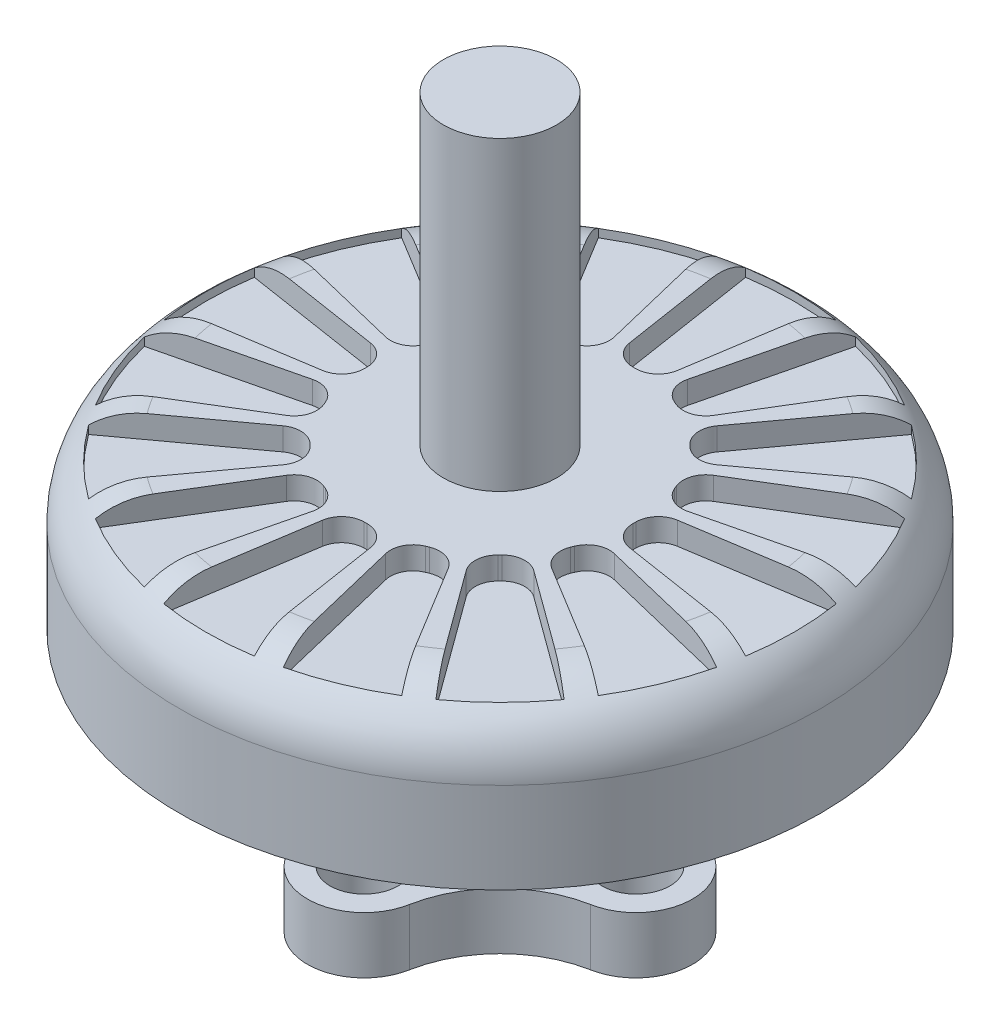
from build123d import *

# Parameters (mm, degrees)
SKETCH1_R           = 1.5
BOSS_EXTRUDE2_DEPTH = 2.5
FILLET1_R           = 3
CUT_EXTRUDE1_DEPTH  = 1


with BuildPart() as part:
    # Sketch1 → Boss-Extrude2 (new body)
    with BuildSketch(Plane(origin=(0, 0, 0), x_dir=(1, 0, 0), z_dir=(0, 1, 0))):
        with BuildLine():
            ThreePointArc((2.457737974, 6.457737974), (0, 8.5), (-2.457737974, 6.457737974))
            ThreePointArc((-2.457737974, 6.457737974), (-3.837680015, 3.837680015), (-6.457737974, 2.457737974))
            ThreePointArc((-6.457737974, 2.457737974), (-8.5, 0), (-6.457737974, -2.457737974))
            ThreePointArc((-6.457737974, -2.457737974), (-3.837680015, -3.837680015), (-2.457737974, -6.457737974))
            ThreePointArc((-2.457737974, -6.457737974), (0, -8.5), (2.457737974, -6.457737974))
            ThreePointArc((2.457737974, -6.457737974), (3.837680015, -3.837680015), (6.457737974, -2.457737974))
            ThreePointArc((6.457737974, -2.457737974), (8.5, 0), (6.457737974, 2.457737974))
            ThreePointArc((6.457737974, 2.457737974), (3.837680015, 3.837680015), (2.457737974, 6.457737974))
        make_face()
        with Locations(Location((0, 6, 0), (0, 0, 270))):
            Circle(SKETCH1_R, mode=Mode.SUBTRACT)
        with Locations(Location((6, 0, 0), (0, 0, 270))):
            Circle(SKETCH1_R, mode=Mode.SUBTRACT)
        with Locations(Location((0, -6, 0), (0, 0, 270))):
            Circle(SKETCH1_R, mode=Mode.SUBTRACT)
        with Locations(Location((-6, 0, 0), (0, 0, 270))):
            Circle(SKETCH1_R, mode=Mode.SUBTRACT)
    extrude(amount=BOSS_EXTRUDE2_DEPTH)

    # Sketch2 → Revolve1 (revolve)
    with BuildSketch(Plane.XY):
        Polygon((0, 29.1), (2.5, 29.1), (2.5, 15.6), (14.15, 15.6), (14.15, 8.6), (3.15, 8.6), (4.4, 2.5), (0, 2.5), align=None)
    revolve(axis=Axis((0, -1000, 0), (0, 1, 0)))

    # Fillet1
    fillet1_edges = [part.edges().sort_by_distance(p)[0] for p in [
        (-14.15, 15.6, 0),
    ]]
    fillet(fillet1_edges, radius=FILLET1_R)

    # Sketch4 → Cut-Extrude1 (cut, symmetric)
    with BuildSketch(Plane(origin=(0, 15.6, 0), x_dir=(1, 0, 0), z_dir=(0, 1, 0))):
        with BuildLine():
            Line((1.054822898, 6.774722729), (2, 12.845232579))
            ThreePointArc((2, 12.845232579), (0, 13), (-2, 12.845232579))
            Line((-2, 12.845232579), (-1.054822898, 6.774722729))
            ThreePointArc((-1.054822898, 6.774722729), (-0.71717172, 6.169014357), (-0.066728084, 5.928568882))
            Line((-0.066728084, 5.928568882), (0.066728084, 5.928568882))
            ThreePointArc((0.066728084, 5.928568882), (0.71717172, 6.169014357), (1.054822898, 6.774722729))
        make_face()
        with BuildLine():
            Line((1.618044861, 6.662690915), (3.067898628, 12.632814335))
            ThreePointArc((3.067898628, 12.632814335), (4.974884621, 12.010433923), (6.763416758, 11.102080605))
            Line((6.763416758, 11.102080605), (3.567103433, 5.85536442))
            ThreePointArc((3.567103433, 5.85536442), (3.023359862, 5.424976365), (2.3304138, 5.451747715))
            Line((2.3304138, 5.451747715), (2.207116377, 5.50281918))
            ThreePointArc((2.207116377, 5.50281918), (1.698199315, 5.973875836), (1.618044861, 6.662690915))
        make_face()
        with BuildLine():
            Line((4.044579958, 5.536324806), (7.6687375, 10.497164625))
            ThreePointArc((7.6687375, 10.497164625), (9.192388155, 9.192388155), (10.497164625, 7.6687375))
            Line((10.497164625, 7.6687375), (5.536324806, 4.044579958))
            ThreePointArc((5.536324806, 4.044579958), (4.869268872, 3.855034899), (4.239315141, 4.144947378))
            Line((4.239315141, 4.144947378), (4.144947378, 4.239315141))
            ThreePointArc((4.144947378, 4.239315141), (3.855034899, 4.869268872), (4.044579958, 5.536324806))
        make_face()
        with BuildLine():
            Line((5.85536442, 3.567103433), (11.102080605, 6.763416758))
            ThreePointArc((11.102080605, 6.763416758), (12.010433923, 4.974884621), (12.632814335, 3.067898628))
            Line((12.632814335, 3.067898628), (6.662690915, 1.618044861))
            ThreePointArc((6.662690915, 1.618044861), (5.973875836, 1.698199315), (5.50281918, 2.207116377))
            Line((5.50281918, 2.207116377), (5.451747715, 2.3304138))
            ThreePointArc((5.451747715, 2.3304138), (5.424976365, 3.023359862), (5.85536442, 3.567103433))
        make_face()
        with BuildLine():
            Line((6.774722729, 1.054822898), (12.845232579, 2))
            ThreePointArc((12.845232579, 2), (13, 0), (12.845232579, -2))
            Line((12.845232579, -2), (6.774722729, -1.054822898))
            ThreePointArc((6.774722729, -1.054822898), (6.169014357, -0.71717172), (5.928568882, -0.066728084))
            Line((5.928568882, -0.066728084), (5.928568882, 0.066728084))
            ThreePointArc((5.928568882, 0.066728084), (6.169014357, 0.71717172), (6.774722729, 1.054822898))
        make_face()
        with BuildLine():
            Line((6.662690915, -1.618044861), (12.632814335, -3.067898628))
            ThreePointArc((12.632814335, -3.067898628), (12.010433923, -4.974884621), (11.102080605, -6.763416758))
            Line((11.102080605, -6.763416758), (5.85536442, -3.567103433))
            ThreePointArc((5.85536442, -3.567103433), (5.424976365, -3.023359862), (5.451747715, -2.3304138))
            Line((5.451747715, -2.3304138), (5.50281918, -2.207116377))
            ThreePointArc((5.50281918, -2.207116377), (5.973875836, -1.698199315), (6.662690915, -1.618044861))
        make_face()
        with BuildLine():
            Line((5.536324806, -4.044579958), (10.497164625, -7.6687375))
            ThreePointArc((10.497164625, -7.6687375), (9.192388155, -9.192388155), (7.6687375, -10.497164625))
            Line((7.6687375, -10.497164625), (4.044579958, -5.536324806))
            ThreePointArc((4.044579958, -5.536324806), (3.855034899, -4.869268872), (4.144947378, -4.239315141))
            Line((4.144947378, -4.239315141), (4.239315141, -4.144947378))
            ThreePointArc((4.239315141, -4.144947378), (4.869268872, -3.855034899), (5.536324806, -4.044579958))
        make_face()
        with BuildLine():
            Line((3.567103433, -5.85536442), (6.763416758, -11.102080605))
            ThreePointArc((6.763416758, -11.102080605), (4.974884621, -12.010433923), (3.067898628, -12.632814335))
            Line((3.067898628, -12.632814335), (1.618044861, -6.662690915))
            ThreePointArc((1.618044861, -6.662690915), (1.698199315, -5.973875836), (2.207116377, -5.50281918))
            Line((2.207116377, -5.50281918), (2.3304138, -5.451747715))
            ThreePointArc((2.3304138, -5.451747715), (3.023359862, -5.424976365), (3.567103433, -5.85536442))
        make_face()
        with BuildLine():
            Line((1.054822898, -6.774722729), (2, -12.845232579))
            ThreePointArc((2, -12.845232579), (0, -13), (-2, -12.845232579))
            Line((-2, -12.845232579), (-1.054822898, -6.774722729))
            ThreePointArc((-1.054822898, -6.774722729), (-0.71717172, -6.169014357), (-0.066728084, -5.928568882))
            Line((-0.066728084, -5.928568882), (0.066728084, -5.928568882))
            ThreePointArc((0.066728084, -5.928568882), (0.71717172, -6.169014357), (1.054822898, -6.774722729))
        make_face()
        with BuildLine():
            Line((-1.618044861, -6.662690915), (-3.067898628, -12.632814335))
            ThreePointArc((-3.067898628, -12.632814335), (-4.974884621, -12.010433923), (-6.763416758, -11.102080605))
            Line((-6.763416758, -11.102080605), (-3.567103433, -5.85536442))
            ThreePointArc((-3.567103433, -5.85536442), (-3.023359862, -5.424976365), (-2.3304138, -5.451747715))
            Line((-2.3304138, -5.451747715), (-2.207116377, -5.50281918))
            ThreePointArc((-2.207116377, -5.50281918), (-1.698199315, -5.973875836), (-1.618044861, -6.662690915))
        make_face()
        with BuildLine():
            Line((-4.044579958, -5.536324806), (-7.6687375, -10.497164625))
            ThreePointArc((-7.6687375, -10.497164625), (-9.192388155, -9.192388155), (-10.497164625, -7.6687375))
            Line((-10.497164625, -7.6687375), (-5.536324806, -4.044579958))
            ThreePointArc((-5.536324806, -4.044579958), (-4.869268872, -3.855034899), (-4.239315141, -4.144947378))
            Line((-4.239315141, -4.144947378), (-4.144947378, -4.239315141))
            ThreePointArc((-4.144947378, -4.239315141), (-3.855034899, -4.869268872), (-4.044579958, -5.536324806))
        make_face()
        with BuildLine():
            Line((-5.85536442, -3.567103433), (-11.102080605, -6.763416758))
            ThreePointArc((-11.102080605, -6.763416758), (-12.010433923, -4.974884621), (-12.632814335, -3.067898628))
            Line((-12.632814335, -3.067898628), (-6.662690915, -1.618044861))
            ThreePointArc((-6.662690915, -1.618044861), (-5.973875836, -1.698199315), (-5.50281918, -2.207116377))
            Line((-5.50281918, -2.207116377), (-5.451747715, -2.3304138))
            ThreePointArc((-5.451747715, -2.3304138), (-5.424976365, -3.023359862), (-5.85536442, -3.567103433))
        make_face()
        with BuildLine():
            Line((-6.774722729, -1.054822898), (-12.845232579, -2))
            ThreePointArc((-12.845232579, -2), (-13, 0), (-12.845232579, 2))
            Line((-12.845232579, 2), (-6.774722729, 1.054822898))
            ThreePointArc((-6.774722729, 1.054822898), (-6.169014357, 0.71717172), (-5.928568882, 0.066728084))
            Line((-5.928568882, 0.066728084), (-5.928568882, -0.066728084))
            ThreePointArc((-5.928568882, -0.066728084), (-6.169014357, -0.71717172), (-6.774722729, -1.054822898))
        make_face()
        with BuildLine():
            Line((-6.662690915, 1.618044861), (-12.632814335, 3.067898628))
            ThreePointArc((-12.632814335, 3.067898628), (-12.010433923, 4.974884621), (-11.102080605, 6.763416758))
            Line((-11.102080605, 6.763416758), (-5.85536442, 3.567103433))
            ThreePointArc((-5.85536442, 3.567103433), (-5.424976365, 3.023359862), (-5.451747715, 2.3304138))
            Line((-5.451747715, 2.3304138), (-5.50281918, 2.207116377))
            ThreePointArc((-5.50281918, 2.207116377), (-5.973875836, 1.698199315), (-6.662690915, 1.618044861))
        make_face()
        with BuildLine():
            Line((-5.536324806, 4.044579958), (-10.497164625, 7.6687375))
            ThreePointArc((-10.497164625, 7.6687375), (-9.192388155, 9.192388155), (-7.6687375, 10.497164625))
            Line((-7.6687375, 10.497164625), (-4.044579958, 5.536324806))
            ThreePointArc((-4.044579958, 5.536324806), (-3.855034899, 4.869268872), (-4.144947378, 4.239315141))
            Line((-4.144947378, 4.239315141), (-4.239315141, 4.144947378))
            ThreePointArc((-4.239315141, 4.144947378), (-4.869268872, 3.855034899), (-5.536324806, 4.044579958))
        make_face()
        with BuildLine():
            Line((-3.567103433, 5.85536442), (-6.763416758, 11.102080605))
            ThreePointArc((-6.763416758, 11.102080605), (-4.974884621, 12.010433923), (-3.067898628, 12.632814335))
            Line((-3.067898628, 12.632814335), (-1.618044861, 6.662690915))
            ThreePointArc((-1.618044861, 6.662690915), (-1.698199315, 5.973875836), (-2.207116377, 5.50281918))
            Line((-2.207116377, 5.50281918), (-2.3304138, 5.451747715))
            ThreePointArc((-2.3304138, 5.451747715), (-3.023359862, 5.424976365), (-3.567103433, 5.85536442))
        make_face()
    extrude(amount=CUT_EXTRUDE1_DEPTH, both=True, mode=Mode.SUBTRACT)


solid = part.part
